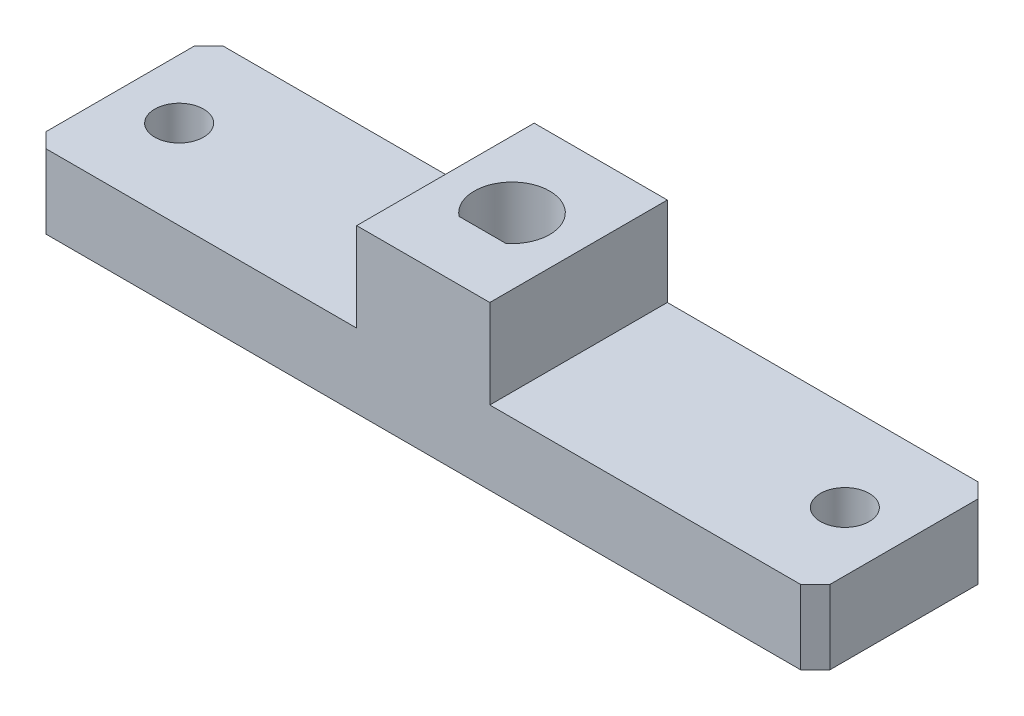
from build123d import *

# Parameters (mm, degrees)
BODY_EXTRUDE_DEPTH              = 12
M4X0_7_TAPPED_HOLE6_D           = 3.3
M4X0_7_TAPPED_HOLE6_CSINK_D     = 4.05
M4X0_7_TAPPED_HOLE6_CSINK_ANGLE = 90
CUT_EXTRUDE1_DEPTH              = 32.10064308
CHAMFER1_SIZE                   = 1


with BuildPart() as part:
    # Sketch1 → Body Extrude (new body)
    with BuildSketch(Plane.XY):
        Polygon((-26.5, 0), (26.5, 0), (26.5, 5), (4.5, 5), (4.5, 11), (-4.5, 11), (-4.5, 5), (-26.5, 5), align=None)
    extrude(amount=-BODY_EXTRUDE_DEPTH)

    # M4x0.7 Tapped Hole6 (through all)
    with Locations(Plane.XZ):
        with Locations((-22.5, -6), (22.5, -6)):
            CounterSinkHole(M4X0_7_TAPPED_HOLE6_D / 2, M4X0_7_TAPPED_HOLE6_CSINK_D / 2, counter_sink_angle=M4X0_7_TAPPED_HOLE6_CSINK_ANGLE)

    # Sketch2 → Cut-Extrude1 (cut, through all)
    with BuildSketch(Plane(origin=(0, 0, 0), x_dir=(1, 0, 0), z_dir=(0, 1, 0))):
        with BuildLine():
            Line((-1.581929202, 4), (1.581929202, 4))
            ThreePointArc((1.581929202, 4), (0, 8.55), (-1.581929202, 4))
        make_face()
    extrude(amount=CUT_EXTRUDE1_DEPTH, mode=Mode.SUBTRACT)

    # Chamfer1
    chamfer1_edges = [part.edges().sort_by_distance(p)[0] for p in [
        (26.5, 2.5, 0),
        (-26.5, 2.5, 0),
        (26.5, 2.5, -12),
        (-26.5, 2.5, -12),
    ]]
    chamfer(chamfer1_edges, length=CHAMFER1_SIZE)


solid = part.part
